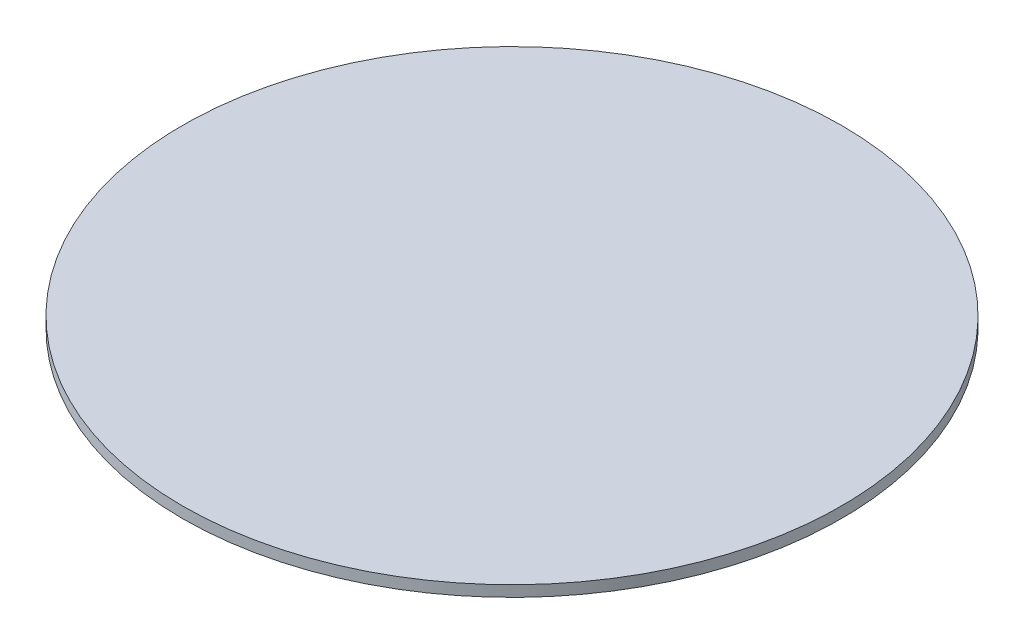
from build123d import *

# Parameters (mm, degrees)
SKETCH_1_R      = 60
EXTRUDE_1_DEPTH = 2


with BuildPart() as part:
    # 草图1 → 凸台-拉伸1 (new body)
    with BuildSketch(Plane(origin=(0, 0, 0), x_dir=(1, 0, 0), z_dir=(0, 1, 0))):
        with Locations(Location((0, 0, 0), (0, 0, 270))):
            Circle(SKETCH_1_R)
    extrude(amount=EXTRUDE_1_DEPTH)


solid = part.part
